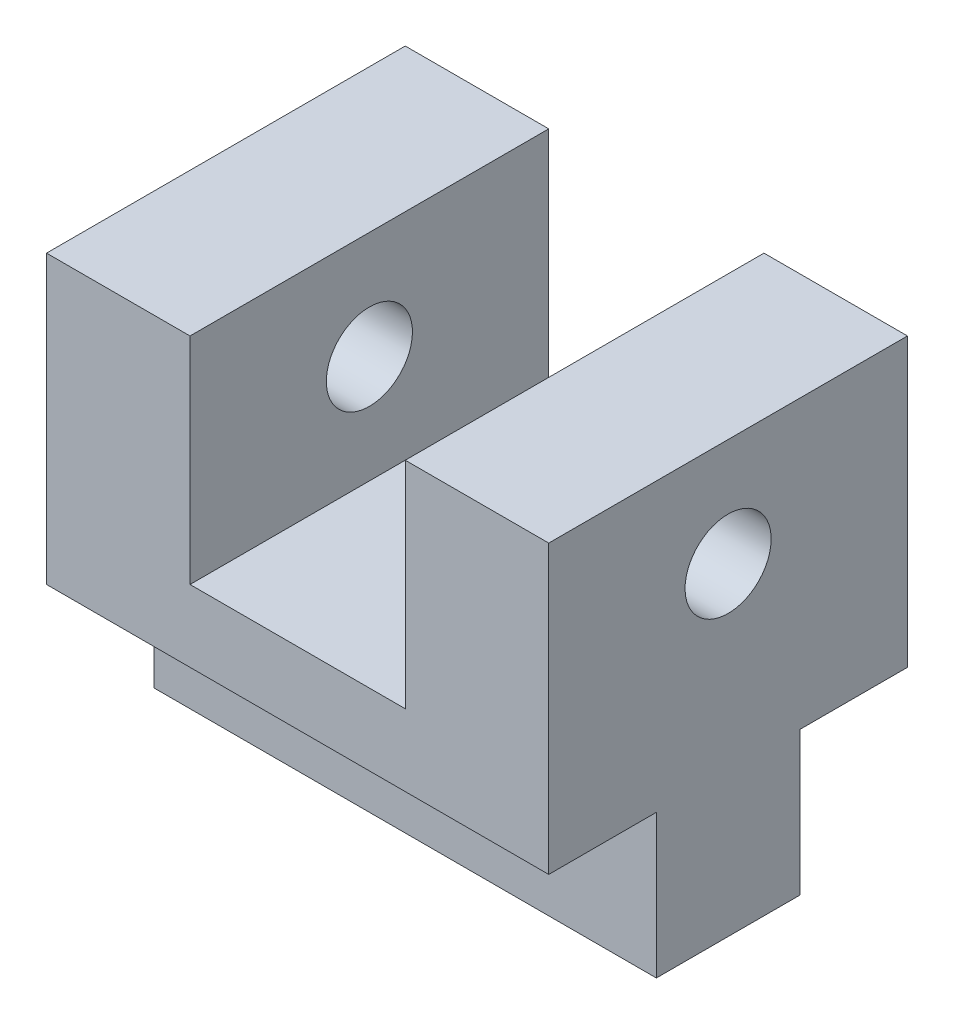
from build123d import *

# Parameters (mm, degrees)
BOSS_EXTRUDE1_DEPTH = 25
SKETCH4_R           = 3
CUT_EXTRUDE1_DEPTH  = 40
SKETCH5_W           = 35
SKETCH5_H           = 10
BOSS_EXTRUDE3_DEPTH = 10


with BuildPart() as part:
    # Sketch1 → Boss-Extrude1 (new body)
    with BuildSketch(Plane.XY):
        Polygon((0, 9.105075836), (0, -5.894924164), (-15, -5.894924164), (-15, 9.105075836), (-25, 9.105075836), (-25, -10.894924164), (10, -10.894924164), (10, 9.105075836), align=None)
    extrude(amount=-BOSS_EXTRUDE1_DEPTH)

    # Sketch4 → Cut-Extrude1 (cut)
    with BuildSketch(Plane(origin=(10, 0, 0), x_dir=(0, 0, -1), z_dir=(1, 0, 0))):
        with Locations(Location((12.5, 1.605075836, 0), (0, 0, 90))):
            Circle(SKETCH4_R)
    extrude(amount=-CUT_EXTRUDE1_DEPTH, mode=Mode.SUBTRACT)

    # Sketch5 → Boss-Extrude3 (add)
    with BuildSketch(Plane.XZ.offset(10.894924164)):
        with Locations((-7.5, -12.5)):
            Rectangle(SKETCH5_W, SKETCH5_H)
    extrude(amount=BOSS_EXTRUDE3_DEPTH)


solid = part.part
